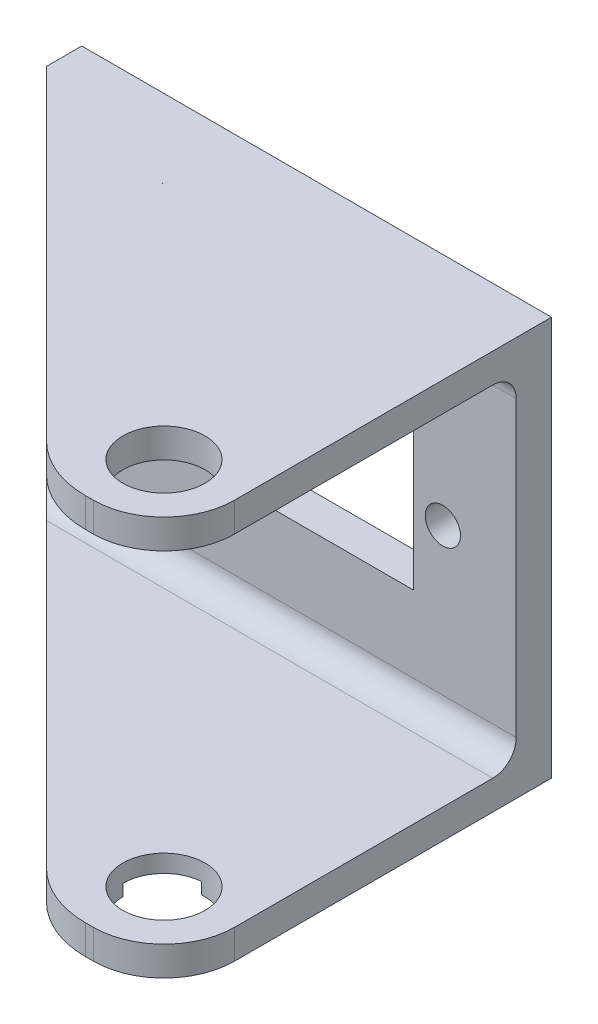
from build123d import *

# Parameters (mm, degrees)
ESBO_O1_W                  = 40
ESBO_O1_H                  = 34
ESBO_O1_R                  = 1.5
ESBO_O1_W_2                = 22.5
ESBO_O1_H_2                = 12
RESSALTO_EXTRUS_O1_DEPTH   = 3
ESBO_O2_W                  = 40
ESBO_O2_H                  = 2.5
RESSALTO_EXTRUS_O2_DEPTH   = 30
CORTE_EXTRUS_O1_DEPTH      = 53.282720471
CORTE_EXTRUS_O1_DEPTH_BACK = 53.282720471
ESBO_O3_R                  = 3.5
FILETE1_R                  = 6
FILETE2_R                  = 2
CORTE_EXTRUS_O2_DEPTH      = 1
FILETE4_R                  = 8


with BuildPart() as part:
    # Esboço1 → Ressalto-extrusão1 (new body)
    with BuildSketch(Plane.XY):
        with Locations((-2.101648352, 0.459478022)):
            Rectangle(ESBO_O1_W, ESBO_O1_H)
        with Locations((11.648351648, 0.459478022)):
            Circle(ESBO_O1_R, mode=Mode.SUBTRACT)
        with Locations(Location((-15.851648352, 0.459478022, 0), (0, 0, 180))):
            Circle(ESBO_O1_R, mode=Mode.SUBTRACT)
        with Locations((-2.101648352, 0.459478022)):
            Rectangle(ESBO_O1_W_2, ESBO_O1_H_2, mode=Mode.SUBTRACT)
    extrude(amount=RESSALTO_EXTRUS_O1_DEPTH)

    # Esboço2 → Ressalto-extrusão2 (add)
    with BuildSketch(Plane.XY.offset(3)):
        with Locations((-2.101648352, 16.209478022)):
            Rectangle(ESBO_O2_W, ESBO_O2_H)
        with Locations((-2.101648352, -15.290521978)):
            Rectangle(ESBO_O2_W, ESBO_O2_H)
    extrude(amount=RESSALTO_EXTRUS_O2_DEPTH)

    # Esboço3 → Corte-extrusão1 (cut, two sides: drawn at the far end of the back side and taken through both)
    with BuildSketch(Plane.XZ.offset(16.540521978).offset(-CORTE_EXTRUS_O1_DEPTH_BACK)):
        with Locations(Location((11.898351648, 27, 0), (0, 0, 270))):
            Circle(ESBO_O3_R)
        Polygon((-22.101648352, 3), (7.898351648, 33), (-22.101648352, 33), align=None)
    extrude(amount=CORTE_EXTRUS_O1_DEPTH + CORTE_EXTRUS_O1_DEPTH_BACK, mode=Mode.SUBTRACT)

    # Filete1
    filete1_edges = [part.edges().sort_by_distance(p)[0] for p in [
        (17.898351648, 16.209478022, 33),
        (17.898351648, -15.290521978, 33),
    ]]
    fillet(filete1_edges, radius=FILETE1_R)

    # Filete2
    filete2_edges = [part.edges().sort_by_distance(p)[0] for p in [
        (-2.101648352, 14.959478022, 3),
        (-2.101648352, -14.040521978, 3),
    ]]
    fillet(filete2_edges, radius=FILETE2_R)

    # Esboço4 → Corte-extrusão2 (cut)
    with BuildSketch(Plane.XZ.offset(16.540521978)):
        Polygon((8.398351648, 27), (-2.157894846, 16.343280995), (1.213419281, 13.003751923), (11.621565934, 23.510961498), align=None)
    extrude(amount=-CORTE_EXTRUS_O2_DEPTH, mode=Mode.SUBTRACT)

    # Filete4
    filete4_edges = [part.edges().sort_by_distance(p)[0] for p in [
        (7.898351648, -15.290521978, 33),
        (7.898351648, 16.209478022, 33),
    ]]
    fillet(filete4_edges, radius=FILETE4_R)


solid = part.part
